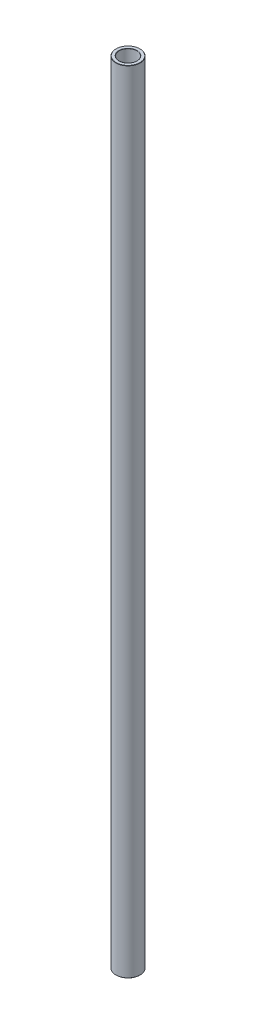
from build123d import *

# Parameters (mm, degrees)
SKETCH1_R           = 12.7
SKETCH1_R_2         = 9.271
BOSS_EXTRUDE1_DEPTH = 827.620000078
CHAMFER1_SIZE       = 0.254
FILLET1_R           = 0.254


with BuildPart() as part:
    # Sketch1 → Boss-Extrude1 (new body)
    with BuildSketch(Plane(origin=(0, 0, 0), x_dir=(1, 0, 0), z_dir=(0, 1, 0))):
        with Locations(Location((0, 0, 0), (0, 0, 90))):
            Circle(SKETCH1_R)
        with Locations(Location((0, 0, 0), (0, 0, 90))):
            Circle(SKETCH1_R_2, mode=Mode.SUBTRACT)
    extrude(amount=BOSS_EXTRUDE1_DEPTH)

    # Chamfer1
    chamfer1_edges = [part.edges().sort_by_distance(p)[0] for p in [
        (0, 0, 12.7),
        (0, 827.620000078, 12.7),
    ]]
    chamfer(chamfer1_edges, length=CHAMFER1_SIZE)

    # Fillet1
    fillet1_edges = [part.edges().sort_by_distance(p)[0] for p in [
        (0, 0, 9.271),
        (0, 827.620000078, 9.271),
    ]]
    fillet(fillet1_edges, radius=FILLET1_R)


solid = part.part
